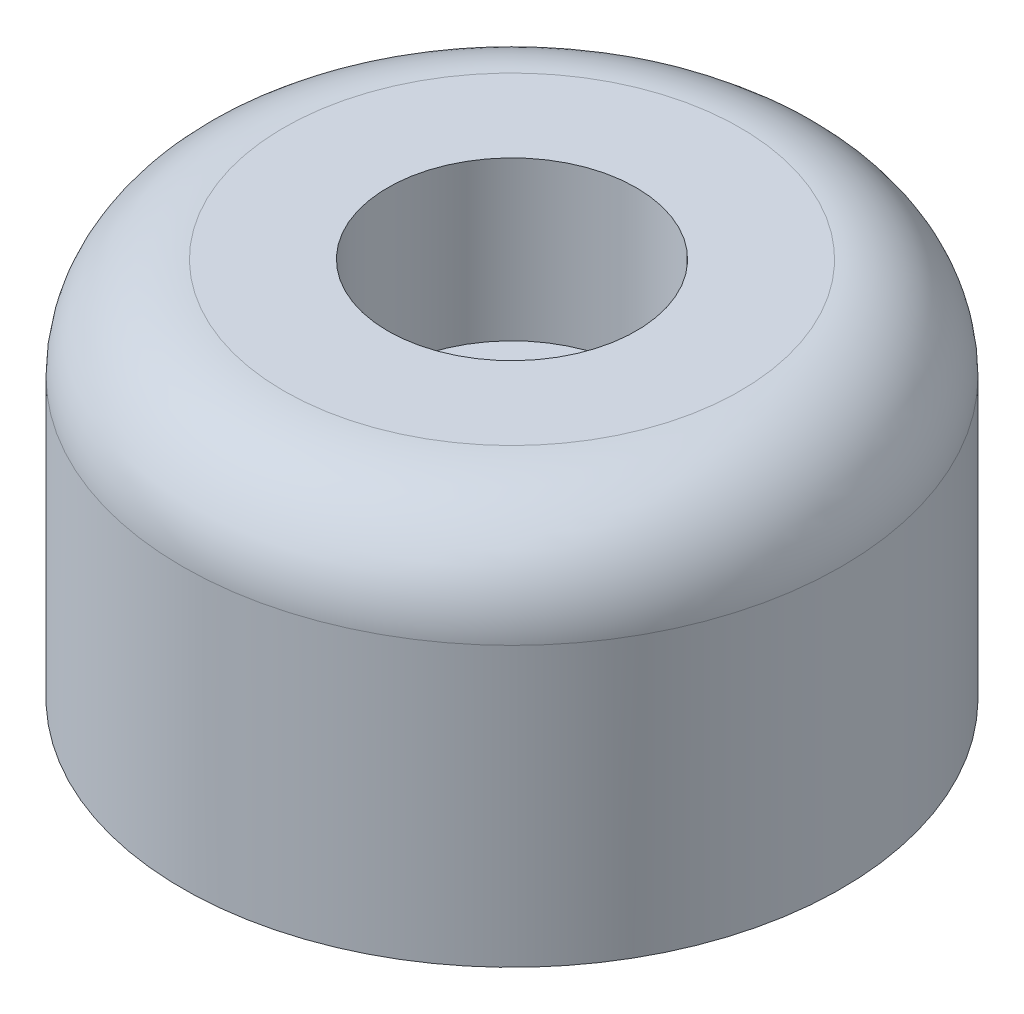
from build123d import *

# Parameters (mm, degrees)
CROQUIS1_R                                           = 16.51
SALIENTE_EXTRUIR1_DEPTH                              = 19.05
REFRENTADO_PARA_TORNILLO_CON_CABEZA_HUEC_D           = 8.2042
REFRENTADO_PARA_TORNILLO_CON_CABEZA_HUEC_DEPTH       = 19.7485
REFRENTADO_PARA_TORNILLO_CON_CABEZA_HUEC_CBORE_D     = 12.446
REFRENTADO_PARA_TORNILLO_CON_CABEZA_HUEC_CBORE_DEPTH = 7.9375
REFRENTADO_PARA_TORNILLO_CON_CABEZA_HUEC_TIP         = 2.464790345
REDONDEO1_R                                          = 5.08


with BuildPart() as part:
    # Croquis1 → Saliente-Extruir1 (new body)
    with BuildSketch(Plane(origin=(0, 0, 0), x_dir=(1, 0, 0), z_dir=(0, 1, 0))):
        with Locations(Location((0, 0, 0), (0, 0, 90))):
            Circle(CROQUIS1_R)
    extrude(amount=SALIENTE_EXTRUIR1_DEPTH)

    # Refrentado para tornillo con cabeza hueca de 5/161
    with Locations(Plane(origin=(0, 19.05, 0), x_dir=(1, 0, 0), z_dir=(0, 1, 0))):
        with Locations((0, 0)):
            CounterBoreHole(REFRENTADO_PARA_TORNILLO_CON_CABEZA_HUEC_D / 2, REFRENTADO_PARA_TORNILLO_CON_CABEZA_HUEC_CBORE_D / 2, REFRENTADO_PARA_TORNILLO_CON_CABEZA_HUEC_CBORE_DEPTH, depth=REFRENTADO_PARA_TORNILLO_CON_CABEZA_HUEC_DEPTH)
            with Locations((0, 0, -(REFRENTADO_PARA_TORNILLO_CON_CABEZA_HUEC_DEPTH + REFRENTADO_PARA_TORNILLO_CON_CABEZA_HUEC_TIP / 2))):  # 118° drill point
                Cone(0, REFRENTADO_PARA_TORNILLO_CON_CABEZA_HUEC_D / 2, REFRENTADO_PARA_TORNILLO_CON_CABEZA_HUEC_TIP, mode=Mode.SUBTRACT)

    # Redondeo1
    redondeo1_edges = [part.edges().sort_by_distance(p)[0] for p in [
        (0, 19.05, 16.51),
    ]]
    fillet(redondeo1_edges, radius=REDONDEO1_R)


solid = part.part
